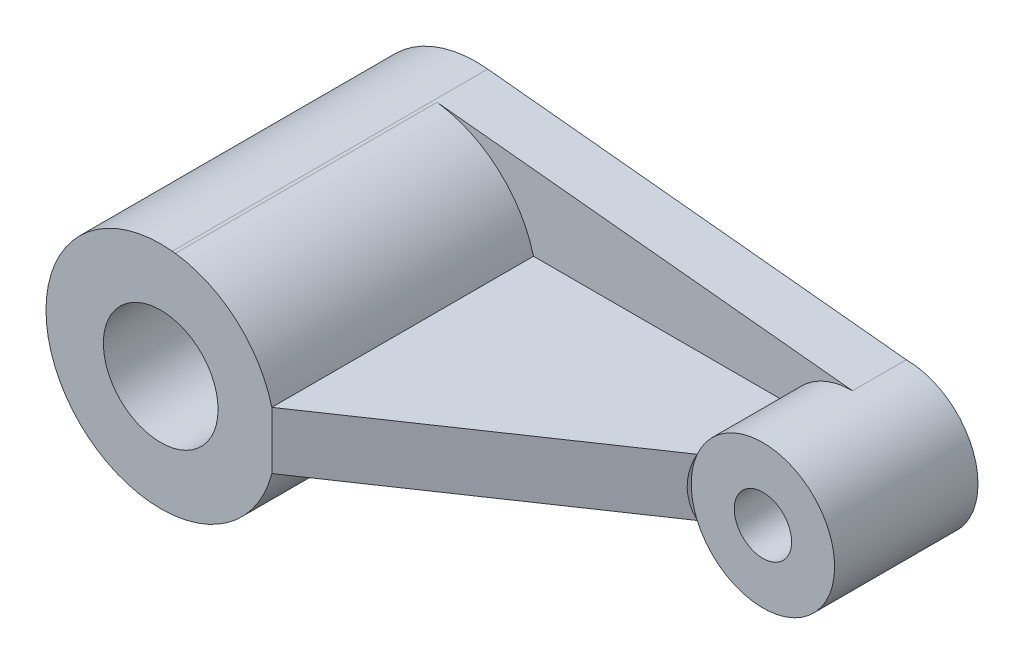
from build123d import *

# Parameters (mm, degrees)
SKETCH1_R           = 16
SKETCH1_R_2         = 8
BOSS_EXTRUDE1_DEPTH = 15
SKETCH2_R           = 16
BOSS_EXTRUDE2_DEPTH = 73
SKETCH2_3_R         = 8
BOSS_EXTRUDE3_DEPTH = 25
BOSS_EXTRUDE7_DEPTH = 73
CUT_EXTRUDE1_DEPTH  = 73


with BuildPart() as part:
    # Sketch1 → Boss-Extrude1 (new body)
    with BuildSketch(Plane(origin=(0, 0, 0), x_dir=(0, 1, 0), z_dir=(0, 0, 1))):
        with BuildLine():
            Line((-31.836853451, -3.227191092), (-20, -120))
            ThreePointArc((-20, -120), (0, -140), (20, -120))
            Line((20, -120), (31.836853451, -3.227191092))
            ThreePointArc((31.836853451, -3.227191092), (0, 32), (-31.836853451, -3.227191092))
        make_face()
        with Locations(Location((0, 0, 0), (0, 0, 270))):
            Circle(SKETCH1_R, mode=Mode.SUBTRACT)
        with Locations(Location((0, -120, 0), (0, 0, 270))):
            Circle(SKETCH1_R_2, mode=Mode.SUBTRACT)
    extrude(amount=BOSS_EXTRUDE1_DEPTH)

    # Sketch2 → Boss-Extrude2 (add)
    with BuildSketch(Plane.XY.offset(15)):
        with BuildLine():
            ThreePointArc((4.090932126, -31.749299027), (24.038632569, -21.139958812), (32.01177462, 0))
            ThreePointArc((32.01177462, 0), (24.038632569, 21.139958812), (4.090932126, 31.749299027))
            Line((4.090932126, 31.749299027), (3.227191092, 31.836853451))
            ThreePointArc((3.227191092, 31.836853451), (-32, 0), (3.227191092, -31.836853451))
            Line((3.227191092, -31.836853451), (4.090932126, -31.749299027))
        make_face()
        Circle(SKETCH2_R, mode=Mode.SUBTRACT)
    extrude(amount=BOSS_EXTRUDE2_DEPTH)

    # Sketch2<3> → Boss-Extrude3 (add)
    with BuildSketch(Plane.XY.offset(15)):
        with BuildLine():
            ThreePointArc((120, -20), (134.142135624, -14.142135624), (140, 0))
            ThreePointArc((140, 0), (134.142135624, 14.142135624), (120, 20))
            ThreePointArc((120, 20), (100, 0), (120, -20))
        make_face()
        with Locations((120, 0)):
            Circle(SKETCH2_3_R, mode=Mode.SUBTRACT)
    extrude(amount=BOSS_EXTRUDE3_DEPTH)

    # Sketch5 → Boss-Extrude7 (add)
    with BuildSketch(Plane.XY.offset(15)):
        with BuildLine():
            ThreePointArc((30.996027396, 8), (31.756822554, 4.032113045), (32.01177462, 0))
            Line((32.01177462, 0), (100, 0))
            ThreePointArc((100, 0), (100.421873741, 4.086192874), (101.66969722, 8))
            Line((101.66969722, 8), (30.996027396, 8))
        make_face()
        with BuildLine():
            Line((100, 0), (32.01177462, 0))
            ThreePointArc((32.01177462, 0), (31.756822554, -4.032113045), (30.996027396, -8))
            Line((30.996027396, -8), (101.66969722, -8))
            ThreePointArc((101.66969722, -8), (100.421873741, -4.086192874), (100, 0))
        make_face()
    extrude(amount=BOSS_EXTRUDE7_DEPTH)

    # Sketch6 → Cut-Extrude1 (cut)
    with BuildSketch(Plane.XZ.offset(8)):
        Polygon((30.996027396, 88), (101.66969722, 40), (101.66969722, 88), align=None)
    extrude(amount=-CUT_EXTRUDE1_DEPTH, mode=Mode.SUBTRACT)


solid = part.part
